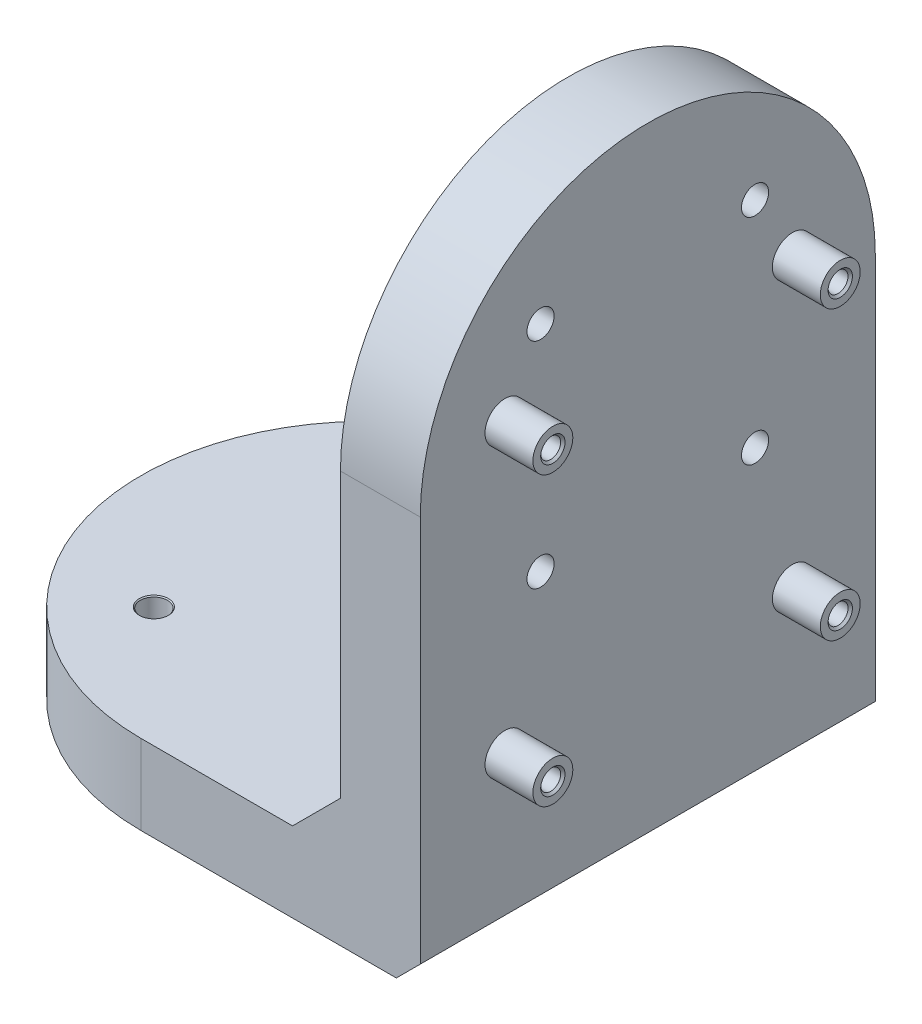
from build123d import *

# Parameters (mm, degrees)
EXTRUDE_1_DEPTH              = 10
SKETCH_2_3_W                 = 10
SKETCH_2_3_H                 = 57
EXTRUDE_2_DEPTH              = 80
HOLE_WIZARD_M3_2_D           = 3.4
HOLE_WIZARD_M3_2_CSINK_D     = 3.65
HOLE_WIZARD_M3_2_CSINK_ANGLE = 90
CUT_EXTRUDE_1_REACH          = 102.372
HOLE_WIZARD_M3_3_D           = 3.4
HOLE_WIZARD_M3_3_CSINK_D     = 3.65
HOLE_WIZARD_M3_3_CSINK_ANGLE = 90
CHAMFER_2_SIZE               = 3
CHAMFER_3_SIZE               = 6
PATTERN_CIRCULAR_1_COUNT     = 4
SKETCH_13_R                  = 2.5
EXTRUDE_3_DEPTH              = 6
HOLE_WIZARD_M3_1_D           = 2.5
HOLE_WIZARD_M3_1_DEPTH       = 5
HOLE_WIZARD_M3_1_CSINK_D     = 3.05
HOLE_WIZARD_M3_1_CSINK_ANGLE = 90
HOLE_WIZARD_M3_1_TIP         = 0.751075774


with BuildPart() as part:
    # 草图2 → 凸台-拉伸1 (new body)
    with BuildSketch(Plane(origin=(0, 0, 0), x_dir=(1, 0, 0), z_dir=(0, 1, 0))):
        with BuildLine():
            Line((25, 28.5), (0, 28.5))
            ThreePointArc((0, 28.5), (-28.5, 0), (0, -28.5))
            Line((0, -28.5), (25, -28.5))
            Line((25, -28.5), (25, 28.5))
        make_face()
    extrude(amount=EXTRUDE_1_DEPTH)

    # 草图2<3> → 凸台-拉伸2 (add)
    with BuildSketch(Plane(origin=(0, 0, 0), x_dir=(1, 0, 0), z_dir=(0, 1, 0))):
        with Locations((30, 0)):
            Rectangle(SKETCH_2_3_W, SKETCH_2_3_H)
    extrude(amount=EXTRUDE_2_DEPTH)

    # M3 间隙孔2 (through all)
    with Locations(Plane(origin=(0, 10, 0), x_dir=(1, 0, 0), z_dir=(0, 1, 0))):
        with Locations((-13.435028843, 13.435028843), (13.435028843, 13.435028843), (13.435028843, -13.435028843), (-13.435028843, -13.435028843)):
            CounterSinkHole(HOLE_WIZARD_M3_2_D / 2, HOLE_WIZARD_M3_2_CSINK_D / 2, counter_sink_angle=HOLE_WIZARD_M3_2_CSINK_ANGLE)

    # 草图10 → 切除-拉伸1 (cut, up to next)
    with BuildSketch(Plane.ZY.offset(-25), mode=Mode.PRIVATE) as cut_extrude_1_sk1:
        with BuildLine():
            ThreePointArc((-28.5, 51.5), (-20.152543264, 71.652543264), (0, 80))
            Line((0, 80), (-28.5, 80))
            Line((-28.5, 80), (-28.5, 51.5))
        make_face()
    cut_extrude_1_tool1 = extrude(cut_extrude_1_sk1.sketch, amount=-CUT_EXTRUDE_1_REACH, mode=Mode.PRIVATE) & part.part
    # 草图10 → 切除-拉伸1 (cut, up to next)
    with BuildSketch(Plane.ZY.offset(-25), mode=Mode.PRIVATE) as cut_extrude_1_sk2:
        with BuildLine():
            Line((28.5, 80), (0, 80))
            ThreePointArc((0, 80), (20.152543264, 71.652543264), (28.5, 51.5))
            Line((28.5, 51.5), (28.5, 80))
        make_face()
    cut_extrude_1_tool2 = extrude(cut_extrude_1_sk2.sketch, amount=-CUT_EXTRUDE_1_REACH, mode=Mode.PRIVATE) & part.part
    add(cut_extrude_1_tool1.solids().sort_by_distance((25, 73.634014, -22.134014))[0], mode=Mode.SUBTRACT)
    add(cut_extrude_1_tool2.solids().sort_by_distance((25, 73.634014, 22.134014))[0], mode=Mode.SUBTRACT)

    # M3 间隙孔3 (through all)
    with Locations(Plane.ZY.offset(-25)):
        with Locations((13.435028843, 64.935028843)):
            hole_wizard_m3_3 = CounterSinkHole(HOLE_WIZARD_M3_3_D / 2, HOLE_WIZARD_M3_3_CSINK_D / 2, counter_sink_angle=HOLE_WIZARD_M3_3_CSINK_ANGLE)

    # 倒角2
    chamfer_2_edges = [part.edges().sort_by_distance(p)[0] for p in [
        (35, 0, 0),
    ]]
    chamfer(chamfer_2_edges, length=CHAMFER_2_SIZE)

    # 倒角3
    chamfer_3_edges = [part.edges().sort_by_distance(p)[0] for p in [
        (25, 10, 0),
    ]]
    chamfer(chamfer_3_edges, length=CHAMFER_3_SIZE)

    # 阵列(圆周)1: M3 间隙孔3 ×4 about axis
    pattern_circular_1_axis = Axis((0, 51.5, 0), (1, 0, 0))
    for i in range(1, PATTERN_CIRCULAR_1_COUNT):
        add(hole_wizard_m3_3.rotate(pattern_circular_1_axis, i * 360 / PATTERN_CIRCULAR_1_COUNT), mode=Mode.SUBTRACT)

    # 草图13 → 凸台-拉伸3 (add)
    with BuildSketch(Plane(origin=(35, 0, 0), x_dir=(0, 0, -1), z_dir=(1, 0, 0))):
        with Locations((-17.891714588, 56.557050395)):
            Circle(SKETCH_13_R)
        with Locations((18.108285412, 56.557050395)):
            Circle(SKETCH_13_R)
        with Locations((18.108285412, 20.557050395)):
            Circle(SKETCH_13_R)
        with Locations((-17.891714588, 20.557050395)):
            Circle(SKETCH_13_R)
    extrude(amount=EXTRUDE_3_DEPTH)

    # M3 螺纹孔1
    with Locations(Plane(origin=(41, 0, 0), x_dir=(0, 0, -1), z_dir=(1, 0, 0))):
        with Locations((-17.891714588, 56.557050395), (18.108285412, 56.557050395), (-17.891714588, 20.557050395), (18.108285412, 20.557050395)):
            CounterSinkHole(HOLE_WIZARD_M3_1_D / 2, HOLE_WIZARD_M3_1_CSINK_D / 2, depth=HOLE_WIZARD_M3_1_DEPTH, counter_sink_angle=HOLE_WIZARD_M3_1_CSINK_ANGLE)
            with Locations((0, 0, -(HOLE_WIZARD_M3_1_DEPTH + HOLE_WIZARD_M3_1_TIP / 2))):  # 118° drill point
                Cone(0, HOLE_WIZARD_M3_1_D / 2, HOLE_WIZARD_M3_1_TIP, mode=Mode.SUBTRACT)


solid = part.part
